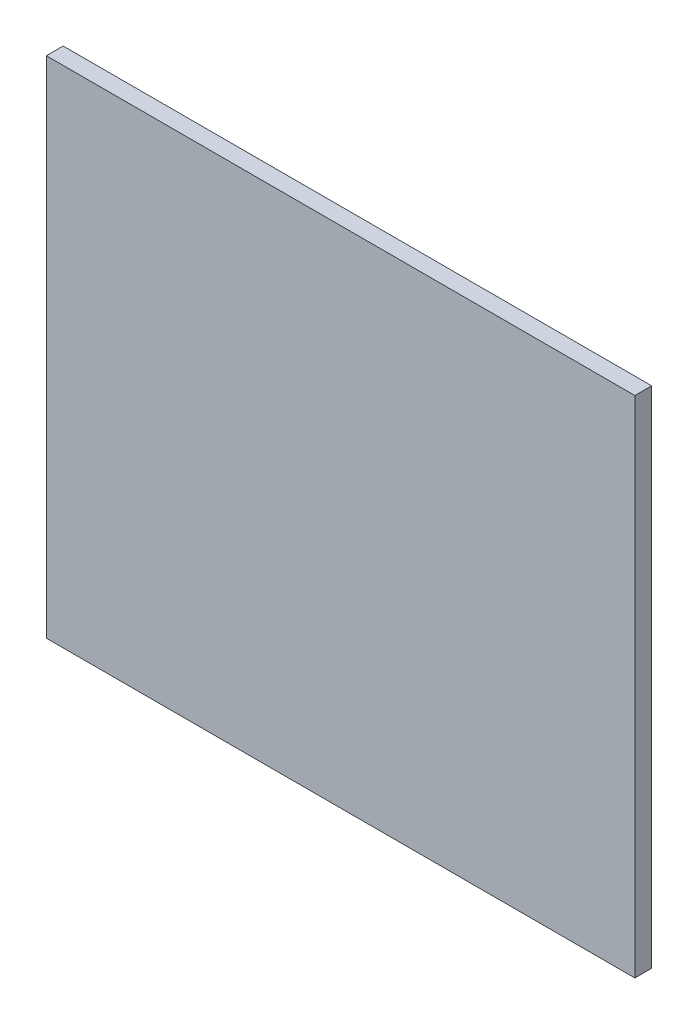
from build123d import *

# Parameters (mm, degrees)
SKETCH_1_W      = 700
SKETCH_1_H      = 600
EXTRUDE_1_DEPTH = 20


with BuildPart() as part:
    # 草图1 → 凸台-拉伸1 (new body)
    with BuildSketch(Plane.XY):
        Rectangle(SKETCH_1_W, SKETCH_1_H)
    extrude(amount=EXTRUDE_1_DEPTH)


solid = part.part
